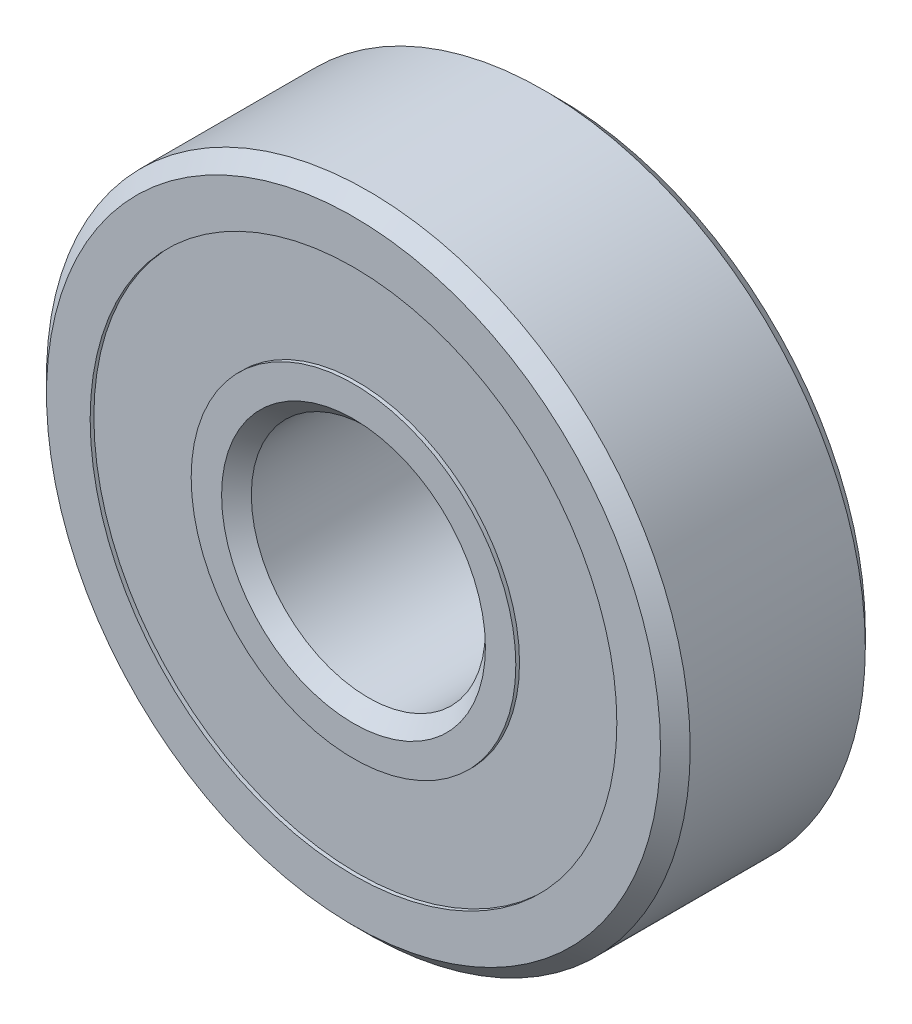
from build123d import *

# Parameters (mm, degrees)
SKETCH1_R           = 11
SKETCH1_R_2         = 4
BOSS_EXTRUDE1_DEPTH = 7
CHAMFER1_SIZE       = 0.508
SKETCH2_R           = 9.000130234
SKETCH2_R_2         = 5.547634914
CUT_EXTRUDE1_DEPTH  = 0.127


with BuildPart() as part:
    # Sketch1 → Boss-Extrude1 (new body)
    with BuildSketch(Plane.XY):
        Circle(SKETCH1_R)
        Circle(SKETCH1_R_2, mode=Mode.SUBTRACT)
    extrude(amount=BOSS_EXTRUDE1_DEPTH)

    # Chamfer1
    chamfer1_edges = [part.edges().sort_by_distance(p)[0] for p in [
        (-11, 0, 0),
        (-11, 0, 7),
        (-4, 0, 7),
    ]]
    chamfer(chamfer1_edges, length=CHAMFER1_SIZE)

    # Sketch2 → Cut-Extrude1 (cut)
    with BuildSketch(Plane(origin=(0, 0, 0), x_dir=(-1, 0, 0), z_dir=(0, 0, -1))):
        Circle(SKETCH2_R)
        Circle(SKETCH2_R_2, mode=Mode.SUBTRACT)
    cut_extrude1 = extrude(amount=-CUT_EXTRUDE1_DEPTH, mode=Mode.SUBTRACT)

    # Mirror1: Cut-Extrude1 across plane
    add(cut_extrude1.mirror(Plane(origin=(0, 0, 3.5), x_dir=(1, 0, 0), z_dir=(0, 0, -1))), mode=Mode.SUBTRACT)


solid = part.part
